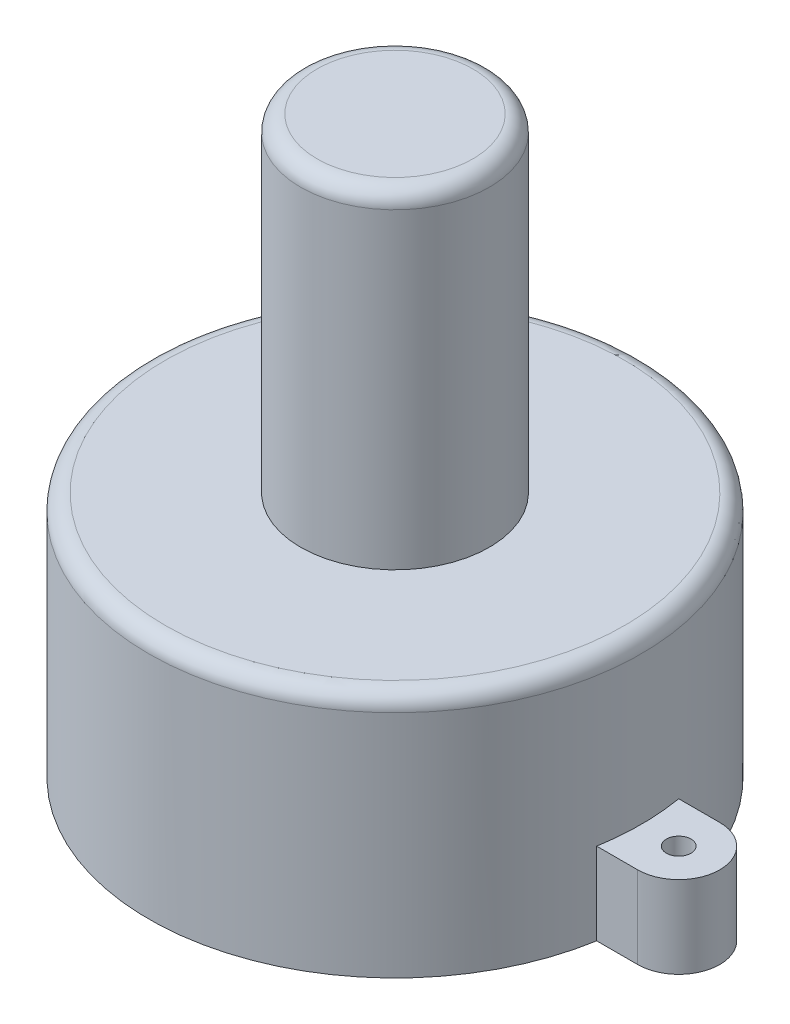
from build123d import *

# Parameters (mm, degrees)
SKETCH_1_R          = 30
SKETCH_1_R_2        = 11.5
EXTRUDE_1_DEPTH     = 30
SKETCH_1_3_R        = 11.5
EXTRUDE_2_DEPTH     = 70
EXTRUDE_3_DEPTH     = 10
FILLET_1_RADIUS     = 5
FILLET_1_LENGTH     = 10
FILLET_2_RADIUS     = 5
FILLET_2_LENGTH     = 10
SKETCH_4_R          = 1.5
CUT_EXTRUDE_1_DEPTH = 78.888432891
FILLET_3_R          = 2


with BuildPart() as part:
    # 草圖1 → 填料-伸長1 (new body)
    # profile 1 of 2: a face of its own
    with BuildSketch(Plane(origin=(0, 0, 0), x_dir=(1, 0, 0), z_dir=(0, 1, 0))):
        with Locations(Location((0, 0, 0), (0, 0, 270))):
            Circle(SKETCH_1_R)
        Circle(SKETCH_1_R_2, mode=Mode.SUBTRACT)
    # profile 2 of 2: a face of its own
    with BuildSketch(Plane(origin=(0, 0, 0), x_dir=(1, 0, 0), z_dir=(0, 1, 0))):
        Circle(SKETCH_1_R_2)
    extrude(amount=EXTRUDE_1_DEPTH)

    # 草圖1<3> → 填料-伸長2 (add)
    with BuildSketch(Plane(origin=(0, 0, 0), x_dir=(1, 0, 0), z_dir=(0, 1, 0))):
        with Locations(Location((0, 0, 0), (0, 0, 270))):
            Circle(SKETCH_1_3_R)
    extrude(amount=EXTRUDE_2_DEPTH)

    # 草圖3 → 填料-伸長3 (add)
    with BuildSketch(Plane.XZ):
        with BuildLine():
            Line((29.580398915, 5), (39.580398915, 5))
            Line((39.580398915, 5), (39.580398915, -5))
            Line((39.580398915, -5), (29.580398915, -5))
            ThreePointArc((29.580398915, -5), (30, 0), (29.580398915, 5))
        make_face()
        with BuildLine():
            Line((-29.580398915, -5), (-39.580398915, -5))
            Line((-39.580398915, -5), (-39.580398915, 5))
            Line((-39.580398915, 5), (-29.580398915, 5))
            ThreePointArc((-29.580398915, 5), (-30, 0), (-29.580398915, -5))
        make_face()
    extrude(amount=-EXTRUDE_3_DEPTH)

    # 圓角1: full round fillet: the end face becomes a half cylinder, R = half its width
    fillet_1_face = Plane((-39.580398915, 5, 0), x_dir=(0, -1, 0), z_dir=(-1, 0, 0))  # on the end face: x along it, z out of the body
    fillet_1_slab = fillet_1_face.offset(-FILLET_1_RADIUS / 2) * Box(FILLET_1_LENGTH, 2 * FILLET_1_RADIUS, FILLET_1_RADIUS, mode=Mode.PRIVATE)  # the body's end, R deep
    fillet_1_round = Plane((-34.580398915, 5, 0), x_dir=(-1, 0, 0), z_dir=(0, -1, 0)) * Cylinder(FILLET_1_RADIUS, FILLET_1_LENGTH, mode=Mode.PRIVATE)  # its axis R under the face
    add(fillet_1_slab - fillet_1_round, mode=Mode.SUBTRACT)

    # 圓角2: full round fillet: the end face becomes a half cylinder, R = half its width
    fillet_2_face = Plane((39.580398915, 5, 0), x_dir=(0, 1, 0), z_dir=(1, 0, 0))  # on the end face: x along it, z out of the body
    fillet_2_slab = fillet_2_face.offset(-FILLET_2_RADIUS / 2) * Box(FILLET_2_LENGTH, 2 * FILLET_2_RADIUS, FILLET_2_RADIUS, mode=Mode.PRIVATE)  # the body's end, R deep
    fillet_2_round = Plane((34.580398915, 5, 0), x_dir=(1, 0, 0), z_dir=(0, 1, 0)) * Cylinder(FILLET_2_RADIUS, FILLET_2_LENGTH, mode=Mode.PRIVATE)  # its axis R under the face
    add(fillet_2_slab - fillet_2_round, mode=Mode.SUBTRACT)

    # 草圖4 → 除料-伸長1 (cut, through all)
    with BuildSketch(Plane(origin=(0, 10, 0), x_dir=(1, 0, 0), z_dir=(0, 1, 0))):
        with Locations(Location((34.580398915, 0, 0), (0, 0, 270))):
            Circle(SKETCH_4_R)
        with Locations(Location((-34.580398915, 0, 0), (0, 0, 270))):
            Circle(SKETCH_4_R)
    extrude(amount=-CUT_EXTRUDE_1_DEPTH, mode=Mode.SUBTRACT)

    # 圓角3
    fillet_3_edges = [part.edges().sort_by_distance(p)[0] for p in [
        (0, 30, -30),
        (0, 70, -11.5),
    ]]
    fillet(fillet_3_edges, radius=FILLET_3_R)


solid = part.part
